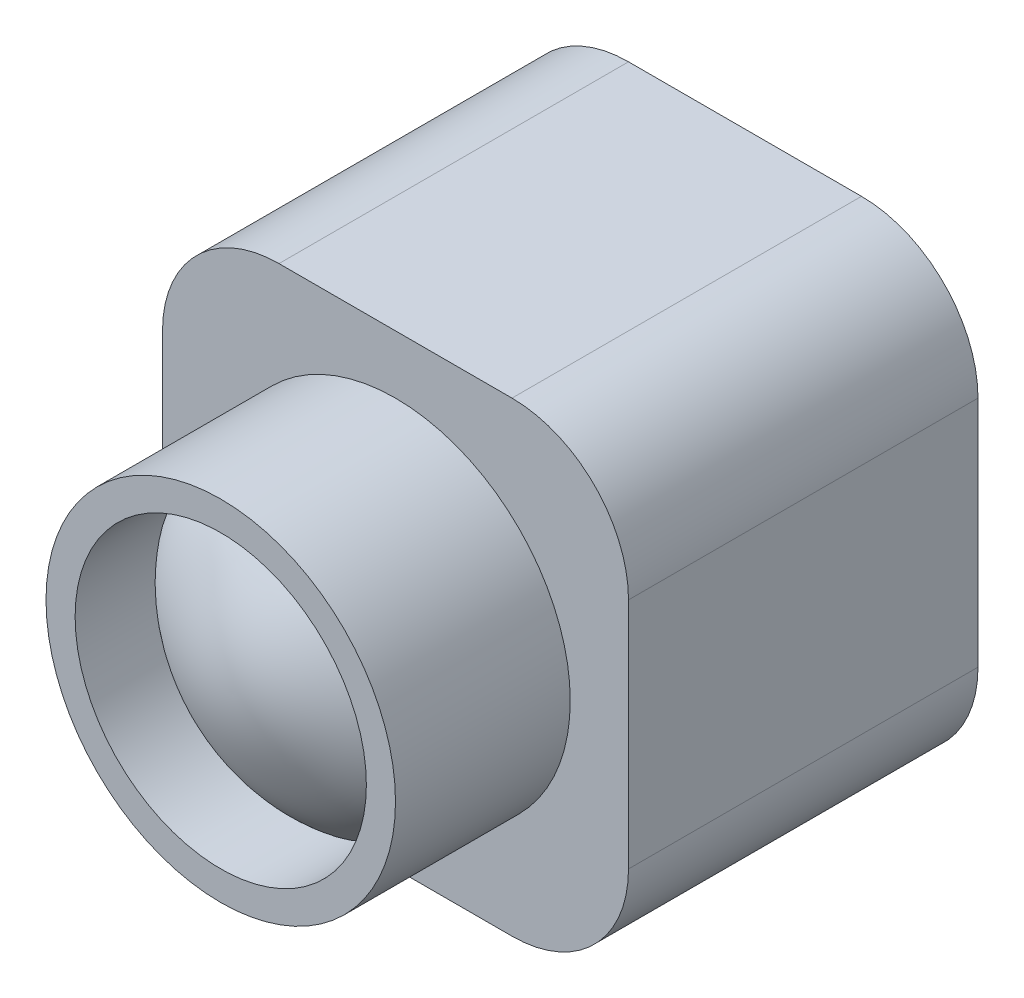
from build123d import *

# Parameters (mm, degrees)
EXTRUDE_1_DEPTH     = 30
SKETCH_2_R          = 15
EXTRUDE_2_DEPTH     = 15
SKETCH_3_R          = 12.5
CUT_EXTRUDE_1_DEPTH = 7


with BuildPart() as part:
    # 草图1 → 凸台-拉伸1 (new body)
    with BuildSketch(Plane.XY):
        with BuildLine():
            Line((-10, -20), (10, -20))
            ThreePointArc((10, -20), (17.071067812, -17.071067812), (20, -10))
            Line((20, -10), (20, 10))
            ThreePointArc((20, 10), (17.071067812, 17.071067812), (10, 20))
            Line((10, 20), (-10, 20))
            ThreePointArc((-10, 20), (-17.071067812, 17.071067812), (-20, 10))
            Line((-20, 10), (-20, -10))
            ThreePointArc((-20, -10), (-17.071067812, -17.071067812), (-10, -20))
        make_face()
    extrude(amount=-EXTRUDE_1_DEPTH)

    # 草图2 → 凸台-拉伸2 (add)
    with BuildSketch(Plane.XY):
        Circle(SKETCH_2_R)
    extrude(amount=EXTRUDE_2_DEPTH)

    # 草图3 → 切除-拉伸1 (cut)
    with BuildSketch(Plane.XY.offset(15)):
        Circle(SKETCH_3_R)
    extrude(amount=-CUT_EXTRUDE_1_DEPTH, mode=Mode.SUBTRACT)

    # 草图4 → 旋转1 (revolve)
    with BuildSketch(Plane(origin=(0, 0, 0), x_dir=(1, 0, 0), z_dir=(0, 1, 0))):
        with BuildLine():
            Line((0, -8), (12.5, -8))
            add(Edge.make_bspline(
                [(0, -14), (2.433971775, -14.017624523), (6.926016956, -12.41143597), (11.019102747, -9.936800199), (12.5, -8)],
                knots=[0, 0, 0, 0, 0.499949421, 1, 1, 1, 1], degree=3))
            Line((0, -14), (0, -8))
        make_face()
    revolve(axis=Axis((0, 0, 20.621681052), (0, 0, -1)))


solid = part.part
